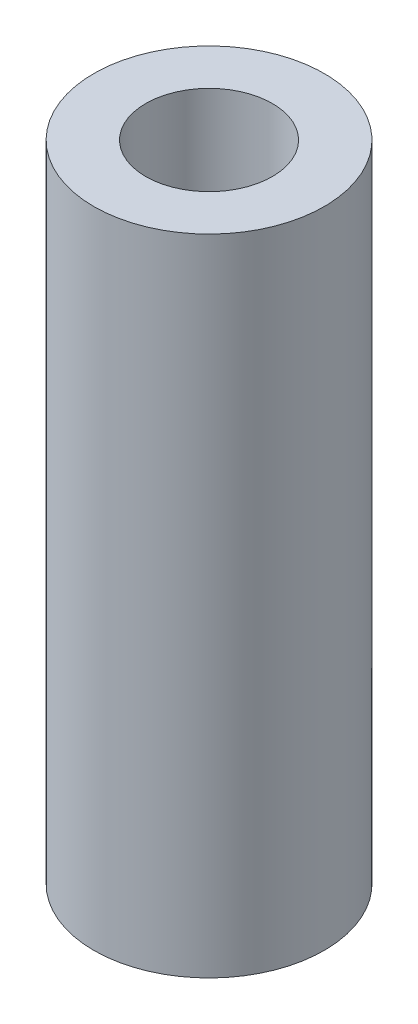
from build123d import *

# Parameters (mm, degrees)
SKETCH1_R           = 3.9751
SKETCH1_R_2         = 2.1844
BOSS_EXTRUDE1_DEPTH = 22.225


with BuildPart() as part:
    # Sketch1 → Boss-Extrude1 (new body)
    with BuildSketch(Plane(origin=(0, 0, 0), x_dir=(1, 0, 0), z_dir=(0, 1, 0))):
        with Locations(Location((0, 0, 0), (0, 0, 270))):
            Circle(SKETCH1_R)
        with Locations(Location((0, 0, 0), (0, 0, 270))):
            Circle(SKETCH1_R_2, mode=Mode.SUBTRACT)
    extrude(amount=BOSS_EXTRUDE1_DEPTH)


solid = part.part
